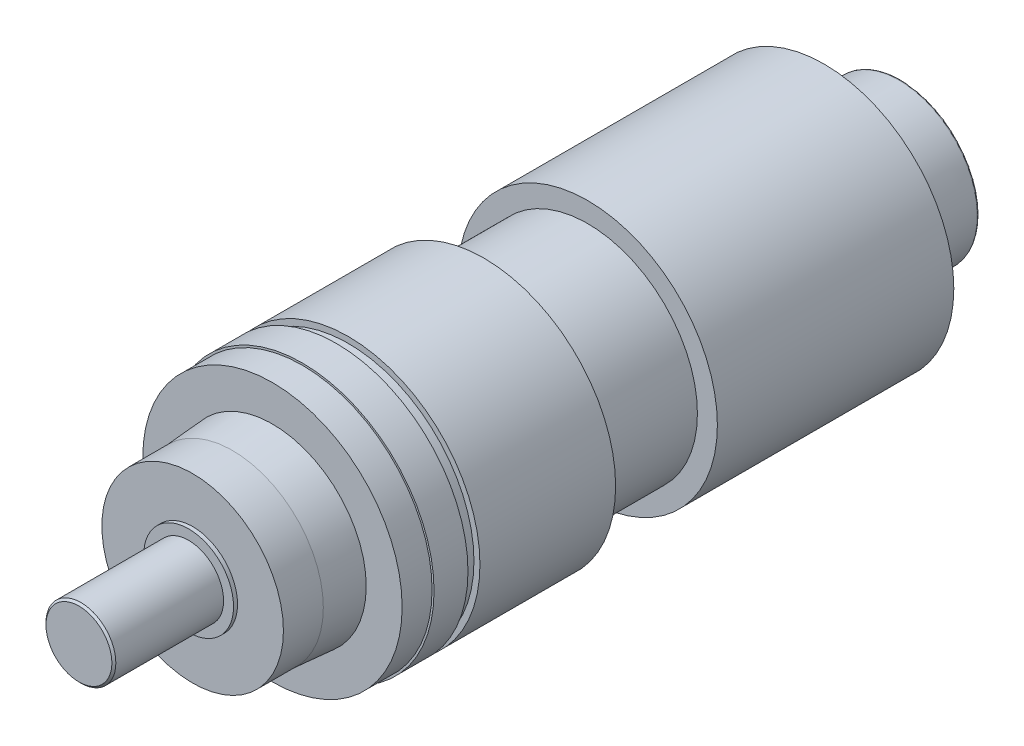
from build123d import *

# Parameters (mm, degrees)
FILLET1_R     = 1
CHAMFER1_SIZE = 1


with BuildPart() as part:
    # Sketch1 → Revolve1 (revolve)
    with BuildSketch(Plane(origin=(0, 0, 0), x_dir=(0, 0, -1), z_dir=(1, 0, 0)), mode=Mode.PRIVATE) as revolve1_sk:
        with BuildLine():
            Line((-55, 0), (358, 0))
            Line((358, 0), (358, 30.75))
            ThreePointArc((358, 30.75), (357.69848481, 34.992640687), (356.8, 39.15))
            Line((356.8, 39.15), (331.5, 40.033495468))
            Line((331.5, 40.033495468), (331.5, 42.5))
            Line((331.5, 42.5), (318.5, 42.5))
            Line((318.5, 42.5), (318.5, 65))
            Line((318.5, 65), (200.002907484, 65))
            Line((200.002907484, 65), (200.002907484, 55))
            Line((200.002907484, 55), (148, 55))
            Line((148, 55), (148, 66))
            Line((148, 66), (80, 66))
            Line((80, 66), (80, 63))
            Line((80, 63), (74, 63))
            Line((74, 63), (74, 66))
            Line((74, 66), (57, 66))
            Line((57, 66), (57, 65))
            Line((57, 65), (42, 65))
            Line((42, 65), (42, 47))
            Line((42, 47), (22, 45.5))
            Line((22, 45.5), (2, 45.5))
            Line((2, 45.5), (2, 22.5))
            Line((2, 22.5), (0, 22.5))
            Line((0, 22.5), (0, 17.5))
            Line((0, 17.5), (-55, 17.5))
            Line((-55, 17.5), (-55, 0))
        make_face()
    revolve(revolve1_sk.sketch.rotate(Axis((0, 0, 61.708002771), (0, 0, -1)), 90), axis=Axis((0, 0, 61.708002771), (0, 0, -1)))

    # Fillet1
    fillet1_edges = [part.edges().sort_by_distance(p)[0] for p in [
        (-39.15, 0, -356.8),
    ]]
    fillet(fillet1_edges, radius=FILLET1_R)

    # Chamfer1
    chamfer1_edges = [part.edges().sort_by_distance(p)[0] for p in [
        (-17.5, 0, 55),
    ]]
    chamfer(chamfer1_edges, length=CHAMFER1_SIZE)


solid = part.part
